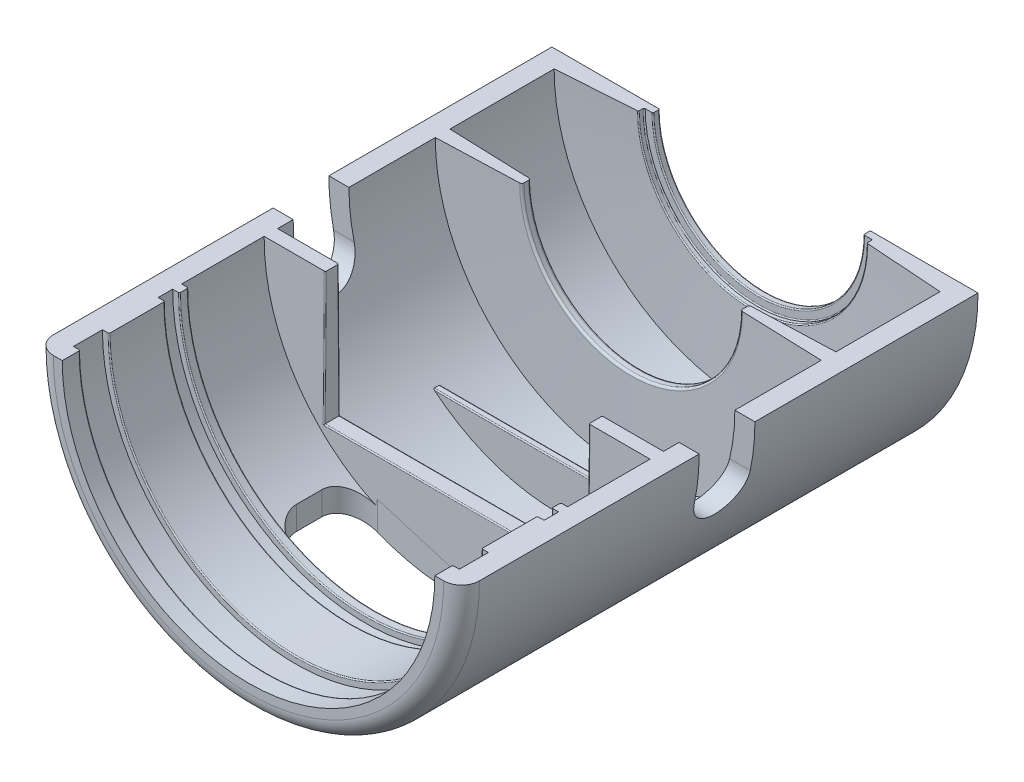
from build123d import *

# Parameters (mm, degrees)
BOSS_EXTRUDE1_DEPTH            = 38.1
REVOLVE1_ANGLE                 = 180
REVOLVE2_ANGLE                 = 180
BOSS_EXTRUDE6_REACH            = 50.466
SKETCH11_W                     = 27.94
SKETCH11_H                     = 1.524
SKETCH12_W                     = 29.21
SKETCH12_H                     = 0.762
BOSS_EXTRUDE7_DEPTH            = 0.762
CUT_EXTRUDE1_DEPTH             = 52.268061188
CUT_EXTRUDE1_DEPTH_BACK        = 52.268061188
REVOLVE3_ANGLE                 = 180
BOSS_EXTRUDE9_REACH            = 53.268
BOSS_EXTRUDE10_REACH           = 70.076
SKETCH18_W                     = 43.942
SKETCH18_H                     = 1.524
BOSS_EXTRUDE10_DRAFT           = -0.5
CUT_EXTRUDE2_REACH             = 49.968
SKETCH21_W                     = 30
SKETCH21_H                     = 30
CUT_EXTRUDE2_DIRECTION_2_REACH = 49.968
FILLET3_R                      = 0.127
FILLET4_R                      = 2.032
CUT_EXTRUDE4_DEPTH             = 69.0761464


with BuildPart() as part:
    # Sketch3 → Boss-Extrude1 (new body)
    with BuildSketch(Plane.XY):
        with BuildLine():
            Line((-24.257, 0), (-21.971, 0))
            ThreePointArc((-21.971, 0), (0, -21.971), (21.971, 0))
            Line((21.971, 0), (24.257, 0))
            ThreePointArc((24.257, 0), (0, -24.257), (-24.257, 0))
        make_face()
    extrude(amount=BOSS_EXTRUDE1_DEPTH)

    # Sketch8 → Revolve1 (revolve)
    with BuildSketch(Plane(origin=(0, 0, 0), x_dir=(-1, 0, 0), z_dir=(0, -1, 0))):
        with BuildLine():
            Line((21.971, 0), (21.971, -2.032))
            Line((21.971, -2.032), (13.122940928, -1.413283437))
            ThreePointArc((13.122940928, -1.413283437), (13.03891808, -1.373206595), (13.0048, -1.286592803))
            Line((13.0048, -1.286592803), (13.0048, -0.889))
            ThreePointArc((13.0048, -0.889), (12.967602561, -0.799197439), (12.8778, -0.762))
            Line((12.8778, -0.762), (12.1158, -0.762))
            ThreePointArc((12.1158, -0.762), (12.025997439, -0.724802561), (11.9888, -0.635))
            Line((11.9888, -0.635), (11.9888, -0.127))
            ThreePointArc((11.9888, -0.127), (12.025997439, -0.037197439), (12.1158, 0))
            Line((12.1158, 0), (21.971, 0))
        make_face()
    revolve(axis=Axis((0, 0, 38.1), (0, 0, 1)), revolution_arc=REVOLVE1_ANGLE)

    # Sketch9 → Revolve2 (revolve)
    with BuildSketch(Plane(origin=(0, 0, 0), x_dir=(-1, 0, 0), z_dir=(0, -1, 0))):
        with BuildLine():
            Line((12.446, -14.98615473), (12.446, -14.47784527))
            ThreePointArc((12.446, -14.47784527), (12.517287691, -14.301402044), (12.691135528, -14.224))
            Line((12.691135528, -14.224), (21.971, -13.899939992))
            Line((21.971, -13.899939992), (21.971, -15.564060008))
            Line((21.971, -15.564060008), (12.691135528, -15.24))
            ThreePointArc((12.691135528, -15.24), (12.517287691, -15.162597956), (12.446, -14.98615473))
        make_face()
    revolve(axis=Axis((0, 0, 38.1), (0, 0, 1)), revolution_arc=REVOLVE2_ANGLE)

    # Sketch11 → Boss-Extrude6 (add, up to next)
    with BuildSketch(Plane(origin=(0, -17.5768, 0), x_dir=(-1, 0, 0), z_dir=(0, -1, 0)), mode=Mode.PRIVATE) as boss_extrude6_sk1:
        with Locations((0, -22.86)):
            Rectangle(SKETCH11_W, SKETCH11_H)
    boss_extrude6_tool1 = extrude(boss_extrude6_sk1.sketch, amount=BOSS_EXTRUDE6_REACH, mode=Mode.PRIVATE) - part.part
    add(boss_extrude6_tool1.solids().sort_by_distance((0, -17.5768, 22.86))[0])

    # Sketch12 → Boss-Extrude7 (add)
    with BuildSketch(Plane(origin=(0, -16.8148, 0), x_dir=(1, 0, 0), z_dir=(0, 1, 0))):
        with Locations((0, -23.241)):
            Rectangle(SKETCH12_W, SKETCH12_H)
    extrude(amount=-BOSS_EXTRUDE7_DEPTH)

    # Sketch13 → Cut-Extrude1 (cut, two sides: drawn at the far end of the back side and taken through both)
    with BuildSketch(Plane(origin=(0, 0, 0), x_dir=(0, 0, -1), z_dir=(1, 0, 0)).offset(-CUT_EXTRUDE1_DEPTH_BACK)):
        with BuildLine():
            Line((-25.4, 89.911564845), (-25.4, 0))
            Line((-25.4, 0), (-25.4, -5.08))
            ThreePointArc((-25.4, -5.08), (-28.575, -8.255), (-31.75, -5.08))
            Line((-31.75, -5.08), (-31.75, 0))
            Line((-31.75, 0), (-31.75, 89.911564845))
            Line((-31.75, 89.911564845), (-31.75, 269.734694535))
            Line((-31.75, 269.734694535), (-25.4, 269.734694535))
            Line((-25.4, 269.734694535), (-25.4, 89.911564845))
        make_face()
    extrude(amount=CUT_EXTRUDE1_DEPTH + CUT_EXTRUDE1_DEPTH_BACK, mode=Mode.SUBTRACT)


with BuildPart() as body_2:
    # Sketch15 → Revolve3 (revolve)
    with BuildSketch(Plane(origin=(0, 0, 0), x_dir=(-1, 0, 0), z_dir=(0, -1, 0))):
        Polygon((21.971, -44.45), (21.209, -44.45), (21.209, -45.466), (21.971, -45.466), (21.971, -47.117), (21.209, -47.117), (21.209, -53.467), (21.971, -53.467), (21.971, -56.769), (21.209, -56.769), (21.209, -58.801), (24.257, -58.801), (24.257, -52.427402605), (24.257, -44.45), align=None)
    revolve(axis=Axis((0, 0, 38.1), (0, 0, 1)), revolution_arc=REVOLVE3_ANGLE)

    # Sketch16 → Boss-Extrude9 (add, up to next)
    with BuildSketch(Plane.XY.offset(38.1), mode=Mode.PRIVATE) as boss_extrude9_sk1:
        with BuildLine():
            Line((24.257, 0), (21.971, 0))
            ThreePointArc((21.971, 0), (0, -21.971), (-21.971, 0))
            Line((-21.971, 0), (-24.257, 0))
            ThreePointArc((-24.257, 0), (0, -24.257), (24.257, 0))
        make_face()
    boss_extrude9_tool1 = extrude(boss_extrude9_sk1.sketch, amount=BOSS_EXTRUDE9_REACH, mode=Mode.PRIVATE) - body_2.part

    add(part.part)  # Boss-Extrude9 merges part
    add(boss_extrude9_tool1.solids().sort_by_distance((23.114, -0.542403, 38.1))[0])




with BuildPart() as boss_extrude10_long_prism_1:
    # Sketch18 → Boss-Extrude10 (the long prism of profile 1, to be tilted and cut off)
    with BuildSketch(Plane(origin=(0, 0, 0), x_dir=(-1, 0, 0), z_dir=(0, -1, 0))):
        with Locations((0, -34.29)):
            Rectangle(SKETCH18_W, SKETCH18_H)
    extrude(amount=BOSS_EXTRUDE10_REACH)
    boss_extrude10_tool1_sides = [boss_extrude10_long_prism_1.faces().sort_by_distance(p)[0] for p in [
        (0, -35.038, 33.528),
        (-21.971, -35.038, 34.29),
        (0, -35.038, 35.052),
        (21.971, -35.038, 34.29),
    ]]
    draft(boss_extrude10_tool1_sides, Plane(origin=(0, 0, 0), x_dir=(-1, 0, 0), z_dir=(0, -1, 0)), BOSS_EXTRUDE10_DRAFT)  # the draft: side faces tilted about the start plane


with BuildPart() as body_2_1:
    add(body_2.part)
    boss_extrude10_tool1 = boss_extrude10_long_prism_1.part - body_2.part
    add(boss_extrude10_tool1.solids().sort_by_distance((0, 0, 34.29))[0])

    # Sketch21 → Cut-Extrude2 (cut, up to next)
    with BuildSketch(Plane.XY.offset(33.528), mode=Mode.PRIVATE) as cut_extrude2_sk1:
        Rectangle(SKETCH21_W, SKETCH21_H)
    cut_extrude2_tool1 = extrude(cut_extrude2_sk1.sketch, amount=-CUT_EXTRUDE2_REACH, mode=Mode.PRIVATE) & body_2_1.part
    add(cut_extrude2_tool1.solids().sort_by_distance((0, 0, 33.528))[0], mode=Mode.SUBTRACT)

    # Sketch21 → Cut-Extrude2 direction 2 (cut, up to next)
    with BuildSketch(Plane.XY.offset(33.528), mode=Mode.PRIVATE) as cut_extrude2_direction_2_sk1:
        Rectangle(SKETCH21_W, SKETCH21_H)
    cut_extrude2_direction_2_tool1 = extrude(cut_extrude2_direction_2_sk1.sketch, amount=CUT_EXTRUDE2_DIRECTION_2_REACH, mode=Mode.PRIVATE) & body_2_1.part
    add(cut_extrude2_direction_2_tool1.solids().sort_by_distance((0, 0, 33.528))[0], mode=Mode.SUBTRACT)

    # Fillet3
    fillet3_edges = [body_2_1.edges().sort_by_distance(p)[0] for p in [
        (0, -21.209, 44.45),
        (0, -21.209, 45.466),
        (0, -21.209, 47.117),
        (0, -21.209, 53.467),
        (0, -21.209, 56.769),
        (0, -15, 35.182903017),
        (-15, -7.5, 35.117451508),
        (15, -7.5, 35.117451508),
        (15, -7.5, 33.462548492),
        (0, -15, 33.397096983),
        (-15, -7.5, 33.462548492),
        (0, -17.5768, 22.098),
        (0, -16.8148, 22.86),
        (0, -16.8148, 23.622),
    ]]
    fillet(fillet3_edges, radius=FILLET3_R)

    # Fillet4
    fillet4_edges = [body_2_1.edges().sort_by_distance(p)[0] for p in [
        (0, -24.257, 58.801),
    ]]
    fillet(fillet4_edges, radius=FILLET4_R)

    # Sketch22 → Cut-Extrude4 (cut, through all)
    with BuildSketch(Plane(origin=(0, 0, 0), x_dir=(-1, 0, 0), z_dir=(0, -1, 0))):
        with BuildLine():
            Line((8.89, -44.45), (-8.89, -44.45))
            ThreePointArc((-8.89, -44.45), (-11.13506403, -43.52006403), (-12.065, -41.275))
            Line((-12.065, -41.275), (-12.065, -38.395541368))
            ThreePointArc((-12.065, -38.395541368), (-11.132131741, -36.147548872), (-8.881711649, -35.220552186))
            Line((-8.881711649, -35.220552186), (0, -35.243738012))
            Line((0, -35.243738012), (8.881711649, -35.220552186))
            ThreePointArc((8.881711649, -35.220552186), (11.132131741, -36.147548872), (12.065, -38.395541368))
            Line((12.065, -38.395541368), (12.065, -41.275))
            ThreePointArc((12.065, -41.275), (11.13506403, -43.52006403), (8.89, -44.45))
        make_face()
    extrude(amount=CUT_EXTRUDE4_DEPTH, mode=Mode.SUBTRACT)


solid = body_2_1.part
